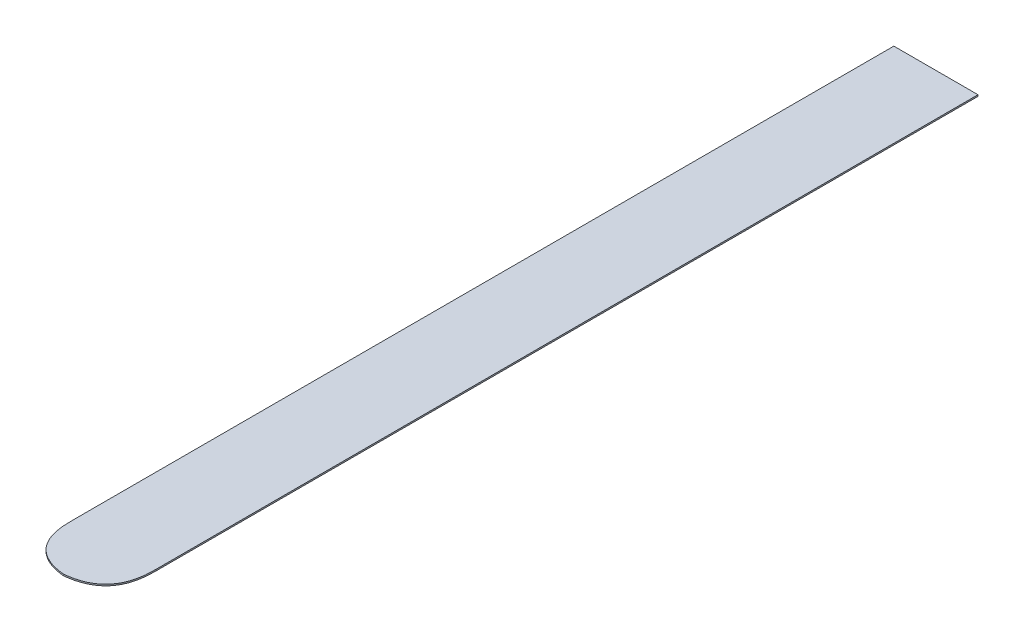
from build123d import *

# Parameters (mm, degrees)
BOSS_EXTRUDE1_DEPTH = 76.2


with BuildPart() as part:
    # Sketch4 → Boss-Extrude1 (new body)
    with BuildSketch(Plane(origin=(0, 0, 0), x_dir=(1, 0, 0), z_dir=(0, 1, 0))):
        with BuildLine():
            Line((-2194.56, 10955.184212568), (-2194.56, -31899.695787432))
            add(Edge.make_bspline(
                [(-2194.56, -31899.695787432), (-2243.378707841, -34319.120962753), (0, -34539.087894)],
                knots=[0, 0, 0, 1, 1, 1], degree=2))
            add(Edge.make_bspline(
                [(2194.56, -31899.695787432), (2243.378707841, -34319.120962753), (0, -34539.087894)],
                knots=[0, 0, 0, 1, 1, 1], degree=2))
            Line((2194.56, -31899.695787432), (2194.56, 10955.184212568))
            Line((2194.56, 10955.184212568), (-2194.56, 10955.184212568))
        make_face()
    extrude(amount=BOSS_EXTRUDE1_DEPTH)


solid = part.part
